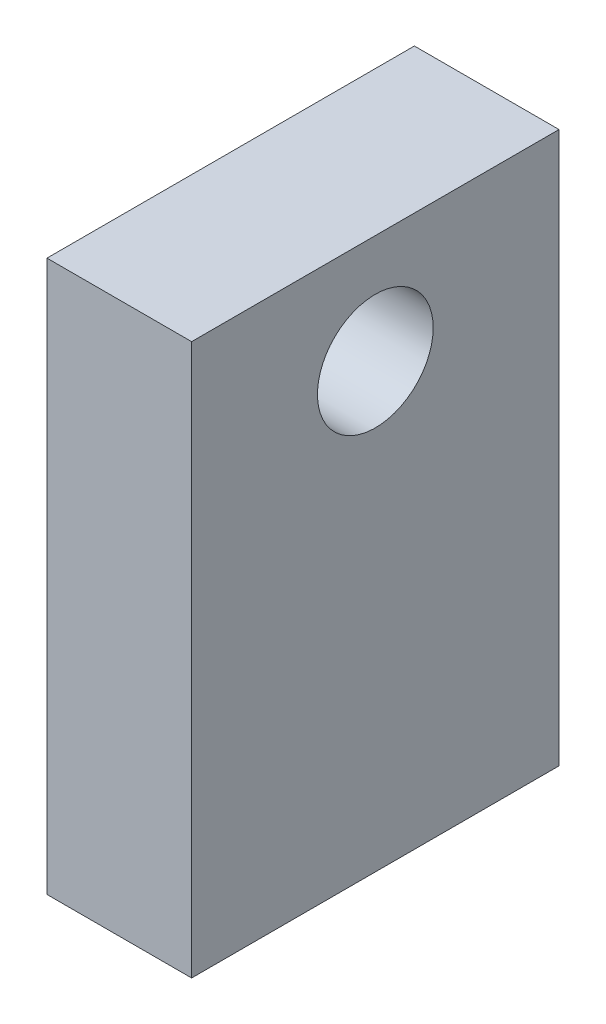
from build123d import *

# Parameters (mm, degrees)
BOSS_EXTRUDE1_DEPTH = 5


with BuildPart() as part:
    # Sketch1 → Boss-Extrude1 (new body)
    with BuildSketch(Plane(origin=(0, 0, 0), x_dir=(0, 0, -1), z_dir=(1, 0, 0))):
        with BuildLine():
            Line((6.35, 17.292870535), (6.35, 19.05))
            Line((6.35, 19.05), (0, 19.05))
            Line((0, 19.05), (0, 0))
            Line((0, 0), (6.35, 0))
            Line((6.35, 0), (6.35, 13.292870535))
            ThreePointArc((6.35, 13.292870535), (4.35, 15.292870535), (6.35, 17.292870535))
        make_face()
        with BuildLine():
            Line((12.7, 19.05), (6.35, 19.05))
            Line((6.35, 19.05), (6.35, 17.292870535))
            ThreePointArc((6.35, 17.292870535), (7.764213562, 16.707084098), (8.35, 15.292870535))
            ThreePointArc((8.35, 15.292870535), (7.764213562, 13.878656973), (6.35, 13.292870535))
            Line((6.35, 13.292870535), (6.35, 0))
            Line((6.35, 0), (12.7, 0))
            Line((12.7, 0), (12.7, 19.05))
        make_face()
    extrude(amount=BOSS_EXTRUDE1_DEPTH)


solid = part.part
